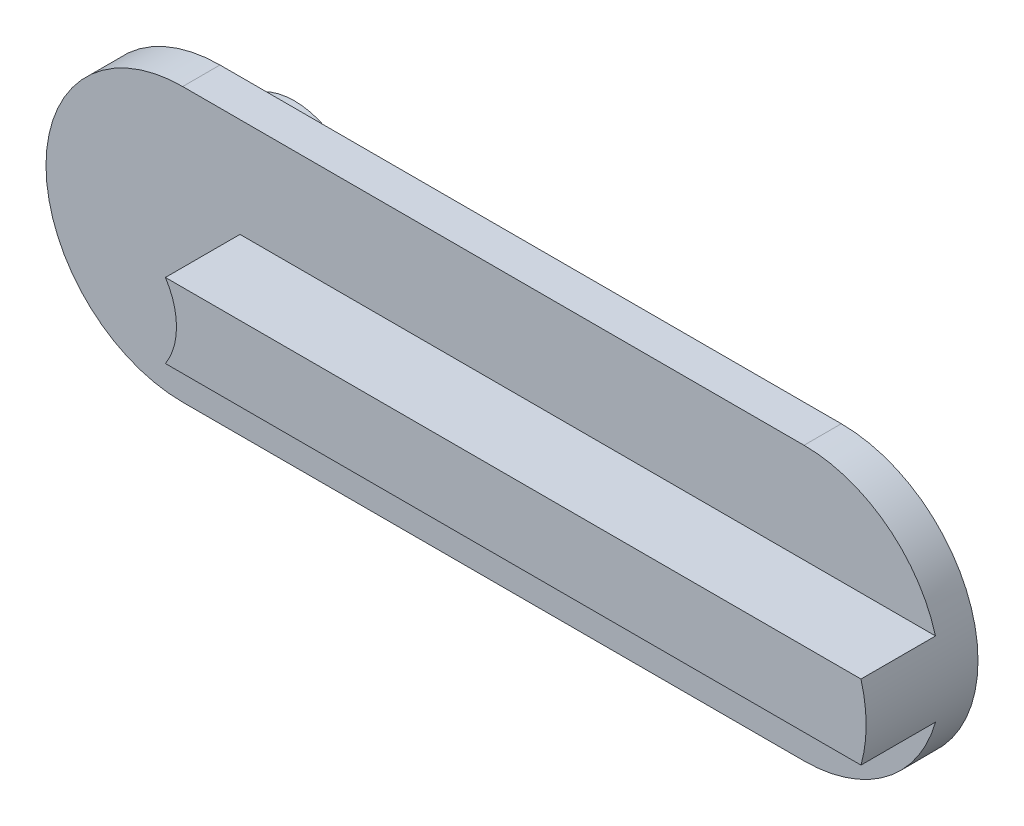
from build123d import *

# Parameters (mm, degrees)
BOSS_EXTRUDE4_DEPTH = 6
BOSS_EXTRUDE6_DEPTH = 12
BOSS_EXTRUDE7_START = 12
SKETCH7_R           = 11
BOSS_EXTRUDE7_DEPTH = 12


with BuildPart() as part:
    # Sketch2 → Boss-Extrude4 (new body)
    with BuildSketch(Plane.XY):
        with BuildLine():
            Line((-50, 22), (50, 22))
            ThreePointArc((50, 22), (72, 0), (50, -22))
            Line((50, -22), (-50, -22))
            ThreePointArc((-50, -22), (-72, 0), (-50, 22))
        make_face()
    extrude(amount=BOSS_EXTRUDE4_DEPTH)

    # Sketch5 → Boss-Extrude6 (add)
    with BuildSketch(Plane.XY.offset(6)):
        with BuildLine():
            Line((-40.780455543, 6), (71.166010489, 6))
            ThreePointArc((71.166010489, 6), (72, 0), (71.166010489, -6))
            Line((71.166010489, -6), (-40.780455543, -6))
            ThreePointArc((-40.780455543, -6), (-39, 0), (-40.780455543, 6))
        make_face()
    extrude(amount=BOSS_EXTRUDE6_DEPTH)

    # Sketch7 → Boss-Extrude7 (add)
    with BuildSketch(Plane(origin=(0, 0, 0), x_dir=(-1, 0, 0), z_dir=(0, 0, -1)).offset(BOSS_EXTRUDE7_START)):
        with Locations(Location((50, 0, 0), (0, 0, 180))):
            Circle(SKETCH7_R)
    extrude(amount=-BOSS_EXTRUDE7_DEPTH)


solid = part.part
